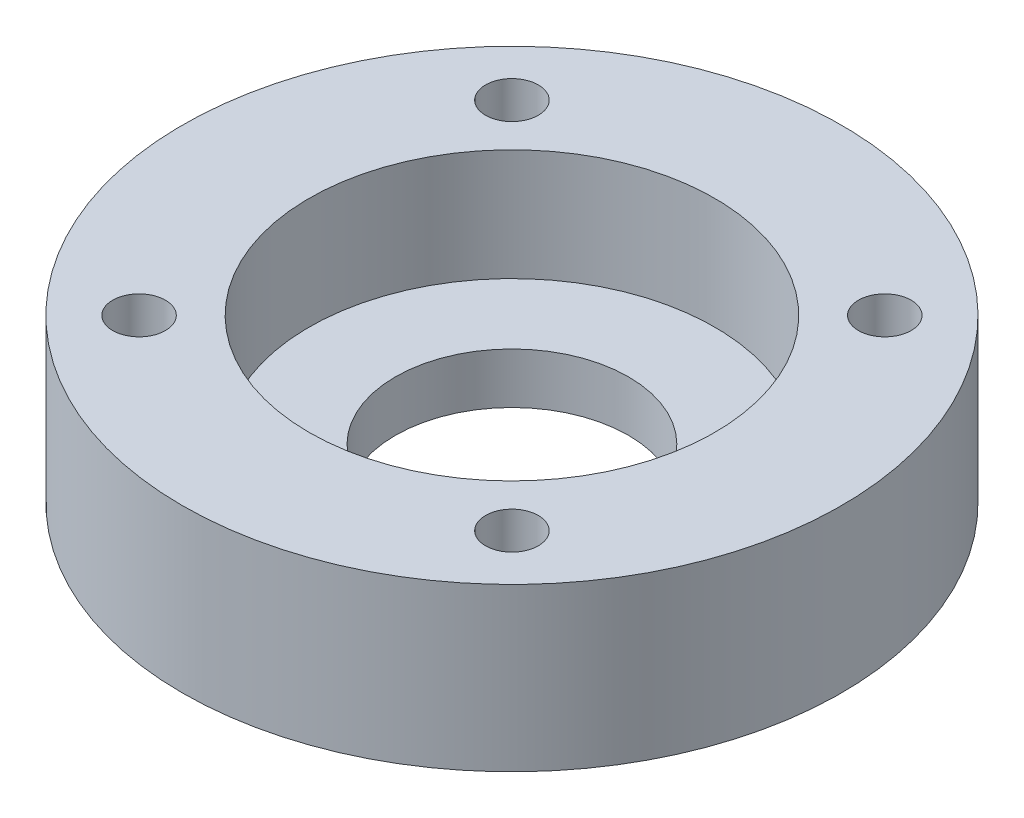
from build123d import *

# Parameters (mm, degrees)
SKETCH1_R           = 32.5
SKETCH1_R_2         = 11.5
SKETCH1_R_3         = 2.6
BOSS_EXTRUDE1_DEPTH = 16
SKETCH2_R           = 20
CUT_EXTRUDE1_DEPTH  = 11


with BuildPart() as part:
    # Sketch1 → Boss-Extrude1 (new body)
    with BuildSketch(Plane(origin=(0, 0, 0), x_dir=(1, 0, 0), z_dir=(0, 1, 0))):
        with Locations(Location((0, 0, 0), (0, 0, 270))):
            Circle(SKETCH1_R)
        with Locations(Location((0, 0, 0), (0, 0, 270))):
            Circle(SKETCH1_R_2, mode=Mode.SUBTRACT)
        with Locations(Location((18.384776311, -18.384776311, 0), (0, 0, 270))):
            Circle(SKETCH1_R_3, mode=Mode.SUBTRACT)
        with Locations(Location((-18.384776311, -18.384776311, 0), (0, 0, 270))):
            Circle(SKETCH1_R_3, mode=Mode.SUBTRACT)
        with Locations(Location((-18.384776311, 18.384776311, 0), (0, 0, 270))):
            Circle(SKETCH1_R_3, mode=Mode.SUBTRACT)
        with Locations(Location((18.384776311, 18.384776311, 0), (0, 0, 270))):
            Circle(SKETCH1_R_3, mode=Mode.SUBTRACT)
    extrude(amount=BOSS_EXTRUDE1_DEPTH)

    # Sketch2 → Cut-Extrude1 (cut)
    with BuildSketch(Plane(origin=(0, 16, 0), x_dir=(1, 0, 0), z_dir=(0, 1, 0))):
        with Locations(Location((0, 0, 0), (0, 0, 270))):
            Circle(SKETCH2_R)
    extrude(amount=-CUT_EXTRUDE1_DEPTH, mode=Mode.SUBTRACT)


solid = part.part
